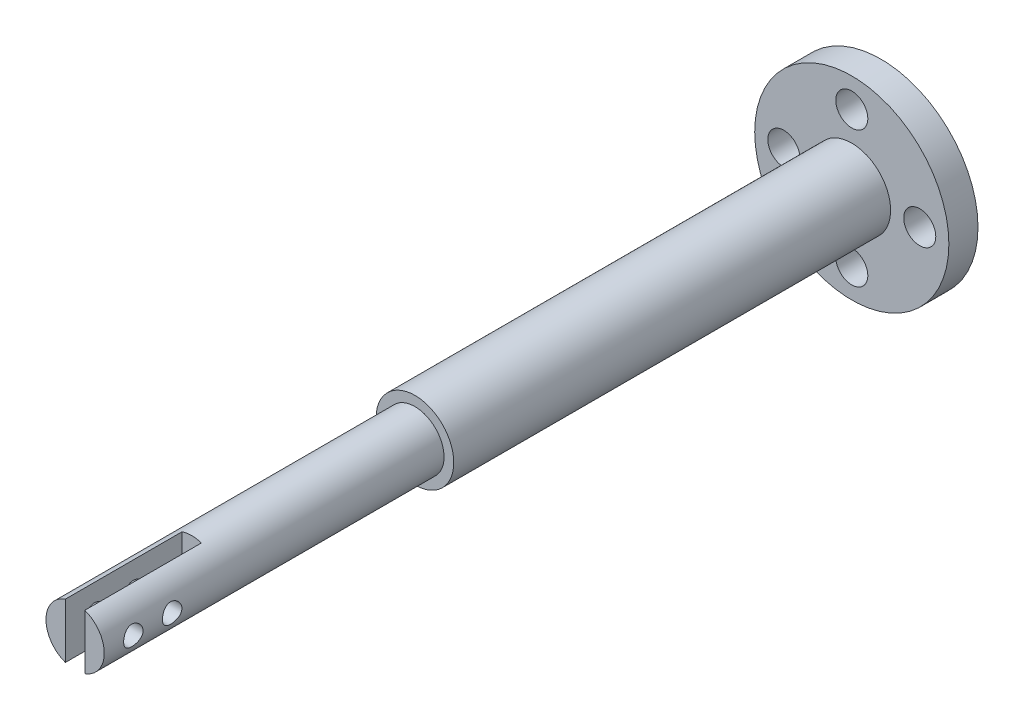
from build123d import *

# Parameters (mm, degrees)
SKETCH_1_R          = 10
SKETCH_1_R_2        = 1.65
EXTRUDE_1_DEPTH     = 3
SKETCH_2_R          = 3
EXTRUDE_2_DEPTH     = 80
SKETCH_3_W          = 2
SKETCH_3_H          = 7.743354912
CUT_EXTRUDE_1_DEPTH = 12
SKETCH_5_R          = 1
CUT_EXTRUDE_2_DEPTH = 5
SKETCH_6_R          = 4
EXTRUDE_3_DEPTH     = 45


with BuildPart() as part:
    # 草图1 → 凸台-拉伸1 (new body)
    with BuildSketch(Plane.XY):
        Circle(SKETCH_1_R)
        with Locations((0, 7)):
            Circle(SKETCH_1_R_2, mode=Mode.SUBTRACT)
        with Locations((7, 0)):
            Circle(SKETCH_1_R_2, mode=Mode.SUBTRACT)
        with Locations((0, -7)):
            Circle(SKETCH_1_R_2, mode=Mode.SUBTRACT)
        with Locations((-7, 0)):
            Circle(SKETCH_1_R_2, mode=Mode.SUBTRACT)
    extrude(amount=EXTRUDE_1_DEPTH)

    # 草图2 → 凸台-拉伸2 (add)
    with BuildSketch(Plane.XY.offset(3)):
        Circle(SKETCH_2_R)
    extrude(amount=EXTRUDE_2_DEPTH)

    # 草图3 → 切除-拉伸1 (cut)
    with BuildSketch(Plane.XY.offset(83)):
        Rectangle(SKETCH_3_W, SKETCH_3_H)
    extrude(amount=-CUT_EXTRUDE_1_DEPTH, mode=Mode.SUBTRACT)

    # 草图5 → 切除-拉伸2 (cut, symmetric)
    with BuildSketch(Plane(origin=(-1, 0, 0), x_dir=(0, 0, -1), z_dir=(1, 0, 0))):
        with Locations(Location((-80, 0, 0), (0, 0, 180))):
            Circle(SKETCH_5_R)
        with Locations(Location((-76, 0, 0), (0, 0, 180))):
            Circle(SKETCH_5_R)
    extrude(amount=CUT_EXTRUDE_2_DEPTH, both=True, mode=Mode.SUBTRACT)

    # 草图6 → 凸台-拉伸3 (add)
    with BuildSketch(Plane.XY.offset(3)):
        with Locations(Location((0, 0, 0), (0, 0, 180))):
            Circle(SKETCH_6_R)
    extrude(amount=EXTRUDE_3_DEPTH)


solid = part.part
